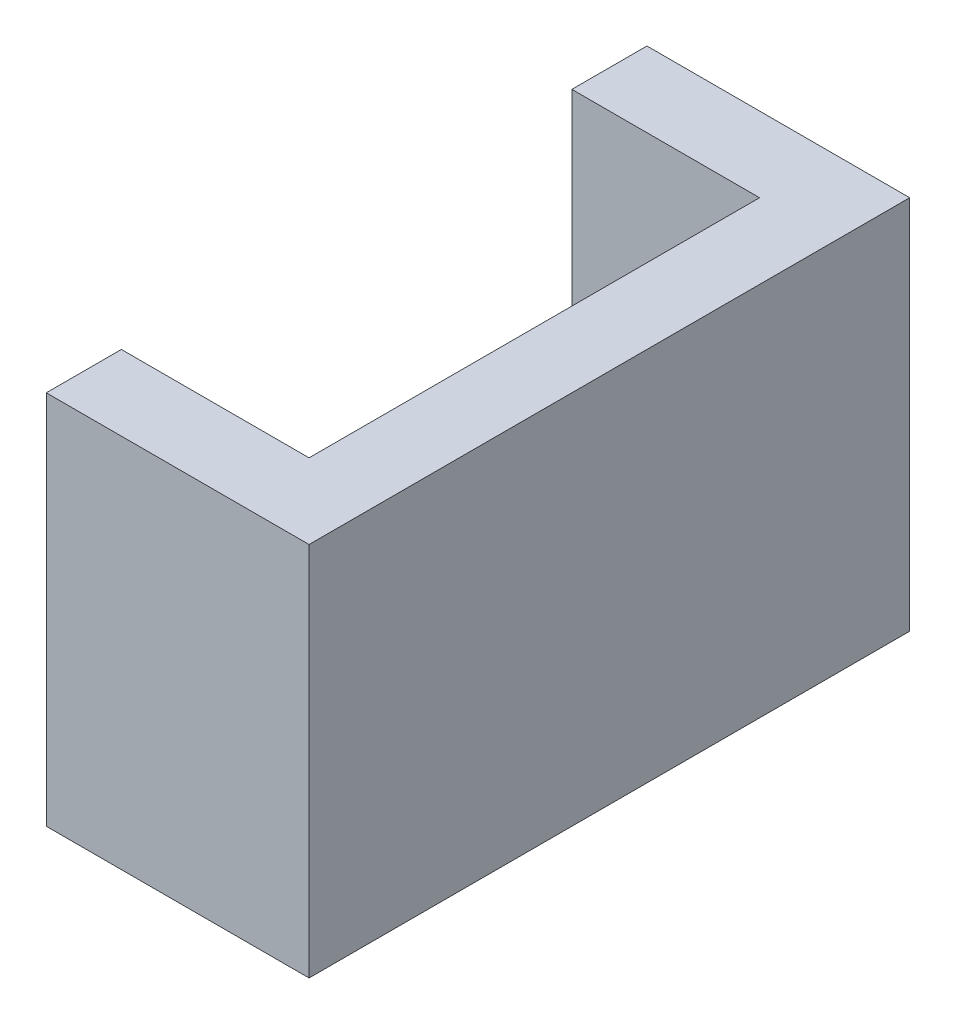
from build123d import *

# Parameters (mm, degrees)
SKETCH1_W           = 16
SKETCH1_H           = 10
BOSS_EXTRUDE1_DEPTH = 7
SKETCH2_W           = 5
SKETCH2_H           = 12
CUT_EXTRUDE1_DEPTH  = 10


with BuildPart() as part:
    # Sketch1 → Boss-Extrude1 (new body)
    with BuildSketch(Plane(origin=(0, 0, 0), x_dir=(0, 0, -1), z_dir=(1, 0, 0))):
        with Locations((0.848192771, -0.855421687)):
            Rectangle(SKETCH1_W, SKETCH1_H)
    extrude(amount=BOSS_EXTRUDE1_DEPTH)

    # Sketch2 → Cut-Extrude1 (cut)
    with BuildSketch(Plane(origin=(0, -5.855421687, 0), x_dir=(-1, 0, 0), z_dir=(0, -1, 0))):
        with Locations((-2.5, 0.848192771)):
            Rectangle(SKETCH2_W, SKETCH2_H)
    extrude(amount=-CUT_EXTRUDE1_DEPTH, mode=Mode.SUBTRACT)


solid = part.part
